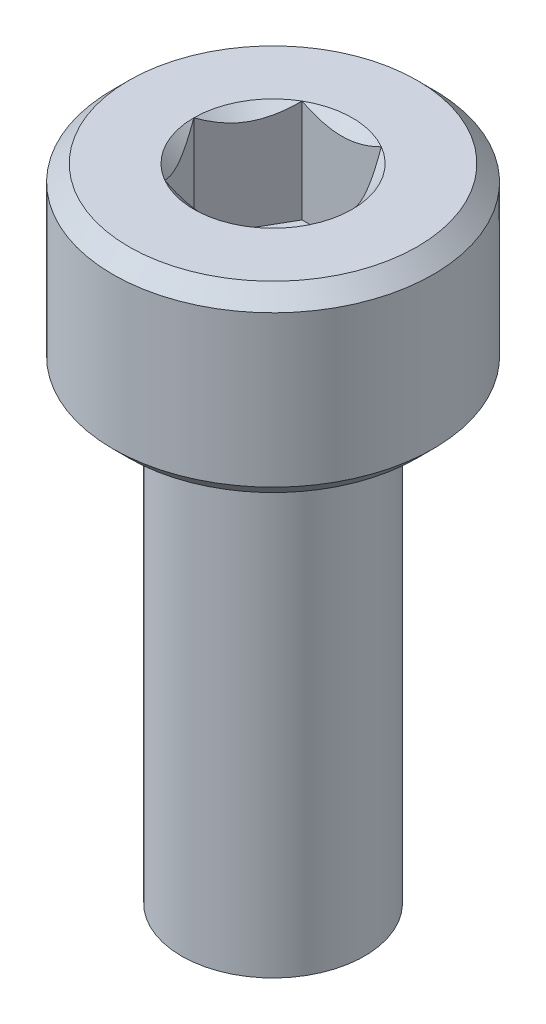
from build123d import *

# Parameters (mm, degrees)
SKETCH1_R           = 3.5
BOSS_EXTRUDE1_DEPTH = 4
CUT_EXTRUDE1_DEPTH  = 2.25
CHAMFER1_SIZE       = 0.35
SKETCH_1_R          = 2
EXTRUDE_1_DEPTH     = 10


with BuildPart() as part:
    # Sketch1 → Boss-Extrude1 (new body)
    with BuildSketch(Plane(origin=(0, 0, 0), x_dir=(1, 0, 0), z_dir=(0, 1, 0))):
        with Locations(Location((0, 0, 0), (0, 0, 270))):
            Circle(SKETCH1_R)
    extrude(amount=BOSS_EXTRUDE1_DEPTH)

    # Sketch2 → Cut-Extrude1 (cut)
    with BuildSketch(Plane(origin=(0, 4, 0), x_dir=(1, 0, 0), z_dir=(0, 1, 0))):
        Polygon((0.866025404, 1.5), (-0.866025404, 1.5), (-1.732050808, 0), (-0.866025404, -1.5), (0.866025404, -1.5), (1.732050808, 0), align=None)
    extrude(amount=-CUT_EXTRUDE1_DEPTH, mode=Mode.SUBTRACT)

    # Cut-Extrude2 cone 1 section (through the dimple's axis) → Cut-Extrude2 (revolve, cut)
    with BuildSketch(Plane(origin=(0, 4, 0), x_dir=(0, 0, 1), z_dir=(1, 0, 0))):
        Polygon((0, 0), (1.732050808, 0), (0, 1.732050808), align=None)
    revolve(axis=Axis((0, 4, 0), (0, -1, 0)), mode=Mode.SUBTRACT)

    # Chamfer1
    chamfer1_edges = [part.edges().sort_by_distance(p)[0] for p in [
        (0, 0, -3.5),
        (0, 4, -3.5),
    ]]
    chamfer(chamfer1_edges, length=CHAMFER1_SIZE)

    # 草图1 → 凸台-拉伸1 (add)
    with BuildSketch(Plane(origin=(0, 0, 0), x_dir=(-1, 0, 0), z_dir=(0, -1, 0))):
        with Locations(Location((0, 0, 0), (0, 0, 90))):
            Circle(SKETCH_1_R)
    extrude(amount=EXTRUDE_1_DEPTH)


solid = part.part
